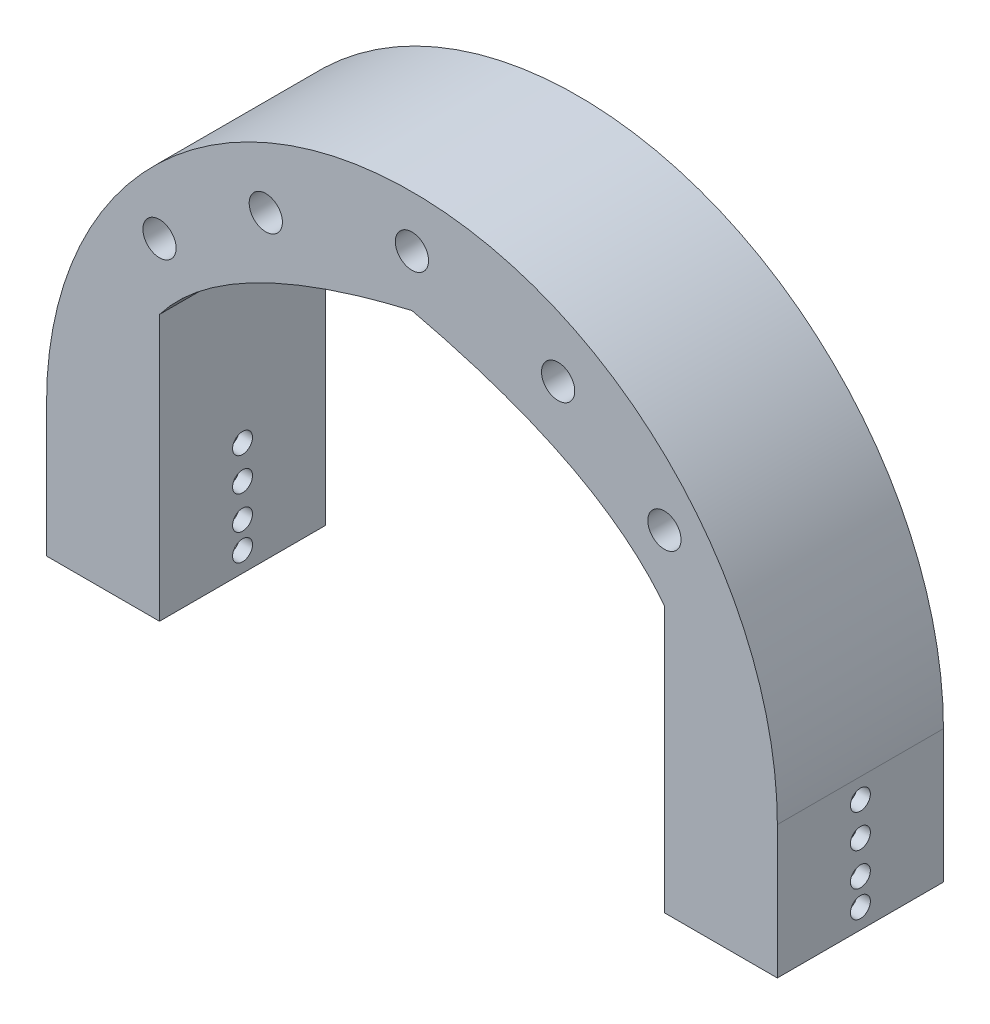
from build123d import *

# Parameters (mm, degrees)
BOSS_EXTRUDE2_DEPTH = 12.5
SKETCH2_W           = 17
SKETCH2_H           = 25
BOSS_EXTRUDE3_DEPTH = 20
SKETCH3_W           = 13
SKETCH3_H           = 19
CUT_EXTRUDE1_DEPTH  = 30
SKETCH4_R           = 1.5
CUT_EXTRUDE2_DEPTH  = 124.617353294
SKETCH5_R           = 2.5
CUT_EXTRUDE3_DEPTH  = 30


with BuildPart() as part:
    # Sketch1 → Boss-Extrude2 (new, symmetric)
    with BuildSketch(Plane.XY):
        with BuildLine():
            Line((-55, 0), (-38, 0))
            Line((-38, 0), (-38, 20))
            add(Edge.make_bspline(
                [(0, 39.5), (-28.167603026, 32.926551341), (-38, 20)],
                knots=[0, 0, 0, 0.331450034, 0.331450034, 0.331450034], degree=2))
            add(Edge.make_bspline(
                [(0, 39.5), (28.167603026, 32.926551341), (38, 20)],
                knots=[0, 0, 0, 0.331450034, 0.331450034, 0.331450034], degree=2))
            Line((38, 20), (38, 0))
            Line((38, 0), (55, 0))
            ThreePointArc((55, 0), (0, 55), (-55, 0))
        make_face()
    extrude(amount=BOSS_EXTRUDE2_DEPTH, both=True)

    # Sketch2 → Boss-Extrude3 (add)
    with BuildSketch(Plane.XZ):
        with Locations((46.5, 0)):
            Rectangle(SKETCH2_W, SKETCH2_H)
        with Locations((-46.5, 0)):
            Rectangle(SKETCH2_W, SKETCH2_H)
    extrude(amount=BOSS_EXTRUDE3_DEPTH)

    # Sketch3 → Cut-Extrude1 (cut)
    with BuildSketch(Plane.XZ.offset(20)):
        with Locations((-46.5, 0)):
            Rectangle(SKETCH3_W, SKETCH3_H)
        with Locations((46.5, 0)):
            Rectangle(SKETCH3_W, SKETCH3_H)
    extrude(amount=-CUT_EXTRUDE1_DEPTH, mode=Mode.SUBTRACT)

    # Sketch4 → Cut-Extrude2 (cut, through all)
    with BuildSketch(Plane.ZY.offset(55)):
        with Locations((0, -3)):
            Circle(SKETCH4_R)
        with Locations((0, -17)):
            Circle(SKETCH4_R)
        with Locations((0, -8)):
            Circle(SKETCH4_R)
        with Locations((0, -13)):
            Circle(SKETCH4_R)
    extrude(amount=-CUT_EXTRUDE2_DEPTH, mode=Mode.SUBTRACT)

    # Sketch5 → Cut-Extrude3 (cut)
    with BuildSketch(Plane.XY.offset(12.5)):
        with Locations((0, 47.25)):
            Circle(SKETCH5_R)
        with Locations((-38, 29.880895352)):
            Circle(SKETCH5_R)
        with Locations((38, 29.880895352)):
            Circle(SKETCH5_R)
        with Locations((-22, 41.266508356)):
            Circle(SKETCH5_R)
        with Locations((22, 41.266508356)):
            Circle(SKETCH5_R)
    extrude(amount=-CUT_EXTRUDE3_DEPTH, mode=Mode.SUBTRACT)


solid = part.part
